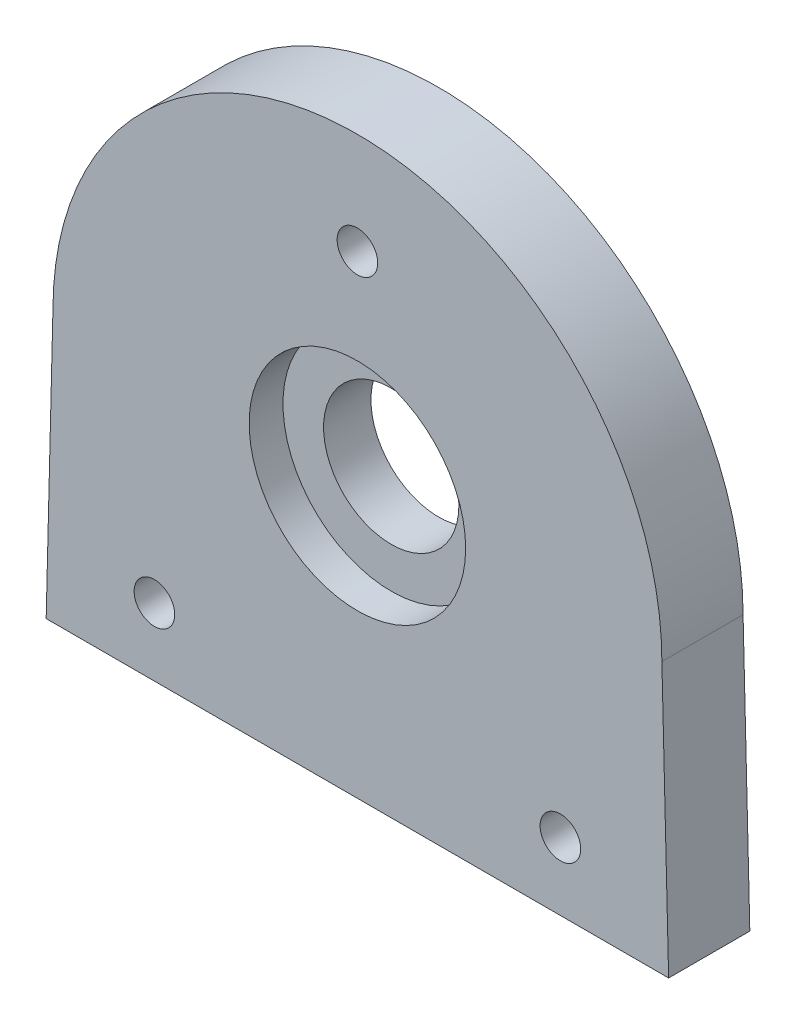
from build123d import *

# Parameters (mm, degrees)
BEARING_HOLDER_BOSS_EXTRUDE1_DEPTH = 6
SKETCH2_R                          = 8
BEARING_HOLE_CUT_EXTRUDE1_DEPTH    = 2.5
SKETCH3_R                          = 5
SHAFT_HOLE_CUT_EXTRUDE2_DEPTH      = 3.5
SKETCH4_R                          = 1.5
MOUNTING_HOLES_CUT_EXTRUDE3_DEPTH  = 6


with BuildPart() as part:
    # Sketch1 → Bearing Holder Boss-Extrude1 (new body)
    with BuildSketch(Plane.XY):
        with BuildLine():
            Line((-22.5, 0), (-22.999267837, -20))
            Line((-22.999267837, -20), (0, -20))
            Line((0, -20), (22.999267837, -20))
            Line((22.999267837, -20), (22.5, 0))
            ThreePointArc((22.5, 0), (0, 22.5), (-22.5, 0))
        make_face()
    extrude(amount=-BEARING_HOLDER_BOSS_EXTRUDE1_DEPTH)

    # Sketch2 → Bearing Hole Cut-Extrude1 (cut)
    with BuildSketch(Plane.XY):
        Circle(SKETCH2_R)
    extrude(amount=-BEARING_HOLE_CUT_EXTRUDE1_DEPTH, mode=Mode.SUBTRACT)

    # Sketch3 → Shaft Hole Cut-Extrude2 (cut)
    with BuildSketch(Plane.XY.offset(-2.5)):
        Circle(SKETCH3_R)
    extrude(amount=-SHAFT_HOLE_CUT_EXTRUDE2_DEPTH, mode=Mode.SUBTRACT)

    # Sketch4 → Mounting Holes Cut-Extrude3 (cut)
    with BuildSketch(Plane.XY):
        with Locations((0, 15)):
            Circle(SKETCH4_R)
        with Locations((-15, -15)):
            Circle(SKETCH4_R)
        with Locations((15, -15)):
            Circle(SKETCH4_R)
    extrude(amount=-MOUNTING_HOLES_CUT_EXTRUDE3_DEPTH, mode=Mode.SUBTRACT)


solid = part.part
